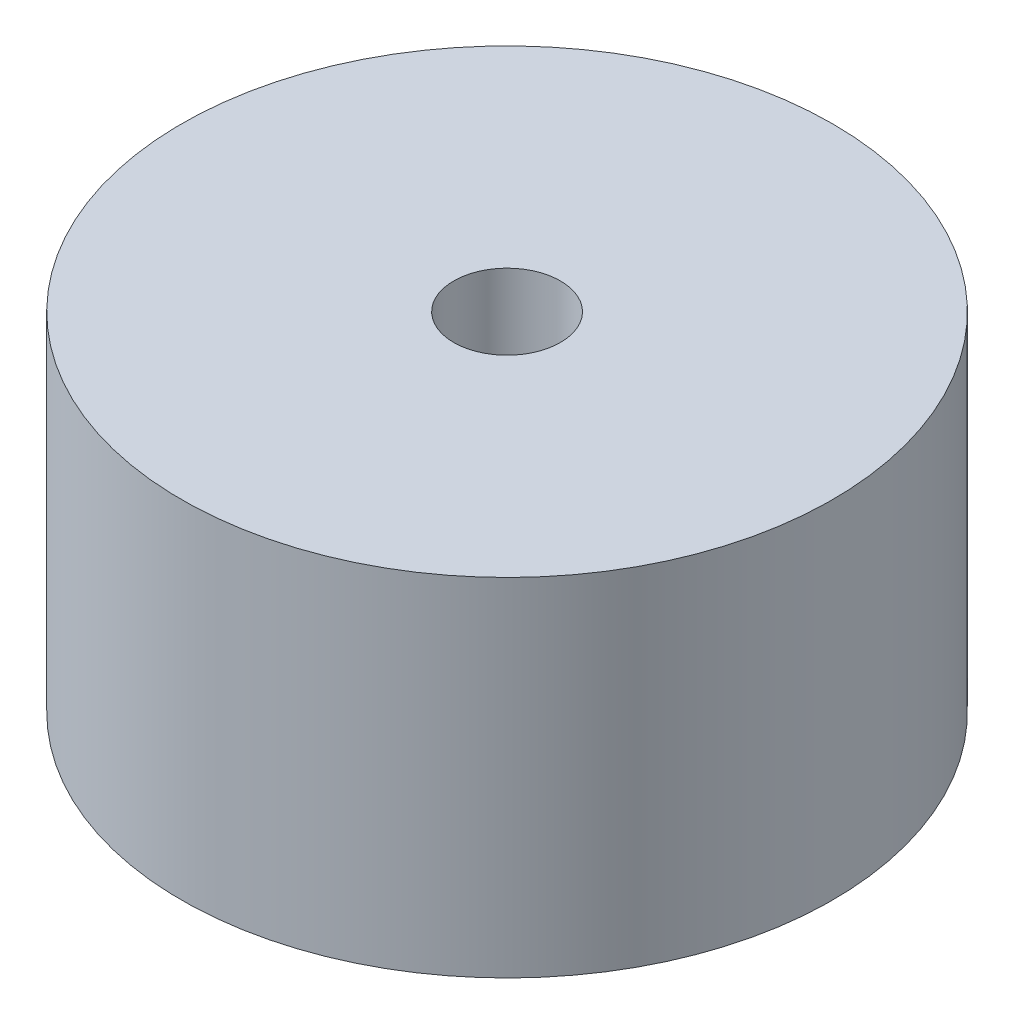
from build123d import *

# Parameters (mm, degrees)
ESQUISSE1_R             = 6.1
BOSS_EXTRU_1_DEPTH      = 6.5
ESQUISSE2_R             = 1
ENL_V_MAT_EXTRU_1_DEPTH = 3


with BuildPart() as part:
    # Esquisse1 → Boss.-Extru.1 (new body)
    with BuildSketch(Plane(origin=(0, 0, 0), x_dir=(1, 0, 0), z_dir=(0, 1, 0))):
        with Locations(Location((19.443183819, -18.306893855, 0), (0, 0, 90))):
            Circle(ESQUISSE1_R)
    extrude(amount=BOSS_EXTRU_1_DEPTH)

    # Esquisse2 → Enlèv. mat.-Extru.1 (cut)
    with BuildSketch(Plane(origin=(0, 6.5, 0), x_dir=(1, 0, 0), z_dir=(0, 1, 0))):
        with Locations(Location((19.443183819, -18.306893855, 0), (0, 0, 270))):
            Circle(ESQUISSE2_R)
    extrude(amount=-ENL_V_MAT_EXTRU_1_DEPTH, mode=Mode.SUBTRACT)


solid = part.part
